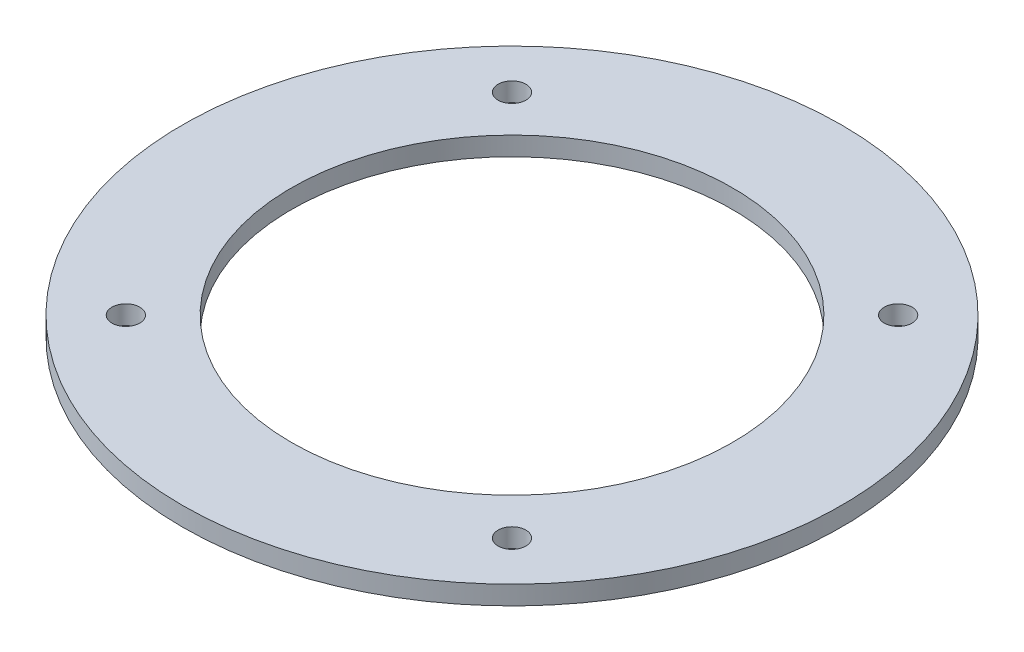
from build123d import *

# Parameters (mm, degrees)
SKETCH1_R           = 35
SKETCH1_R_2         = 23.425
SKETCH1_R_3         = 1.475
BOSS_EXTRUDE1_DEPTH = 1


with BuildPart() as part:
    # Sketch1 → Boss-Extrude1 (new, symmetric)
    with BuildSketch(Plane(origin=(0, 0, 0), x_dir=(1, 0, 0), z_dir=(0, 1, 0))):
        with Locations(Location((0, 0, 0), (0, 0, 270))):
            Circle(SKETCH1_R)
        with Locations(Location((0, 0, 0), (0, 0, 270))):
            Circle(SKETCH1_R_2, mode=Mode.SUBTRACT)
        with Locations(Location((-20.505, 20.505, 0), (0, 0, 270))):
            Circle(SKETCH1_R_3, mode=Mode.SUBTRACT)
        with Locations(Location((20.505, 20.505, 0), (0, 0, 90))):
            Circle(SKETCH1_R_3, mode=Mode.SUBTRACT)
        with Locations(Location((20.505, -20.505, 0), (0, 0, 270))):
            Circle(SKETCH1_R_3, mode=Mode.SUBTRACT)
        with Locations(Location((-20.505, -20.505, 0), (0, 0, 90))):
            Circle(SKETCH1_R_3, mode=Mode.SUBTRACT)
    extrude(amount=BOSS_EXTRUDE1_DEPTH, both=True)


solid = part.part
